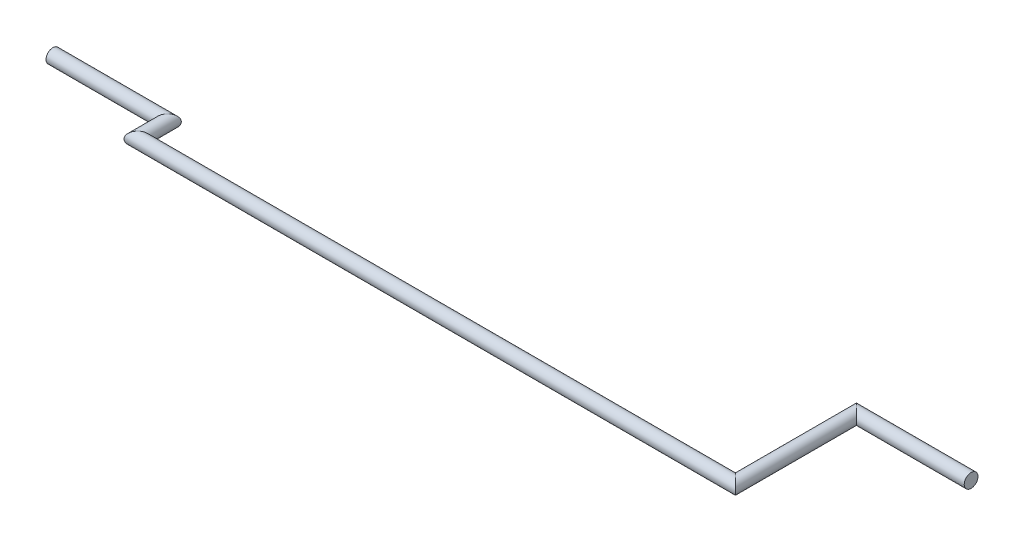
from build123d import *

# Parameters (mm, degrees)
SWEEP1_PROFILE_R = 0.6


with BuildPart() as part:
    # Sweep1: sweep along a path in Sketch1
    with BuildLine(Plane(origin=(0, 0, 0), x_dir=(1, 0, 0), z_dir=(0, 1, 0))) as sweep1_path:
        Line((62.11, 10.55), (52.11, 10.55))
        Line((52.11, 10.55), (52.11, 0))
        Line((52.11, 0), (0, 0))
        Line((0, 0), (0, 2.6))
        Line((0, 2.6), (-10, 2.6))
    # Sweep1 profile (on start of the path) → Sweep1 (sweep)
    with BuildSketch(Plane(origin=(62.11, 0, -10.55), x_dir=(0, 0, -1), z_dir=(-1, 0, 0))):
        Circle(SWEEP1_PROFILE_R)
    sweep(path=sweep1_path.line, transition=Transition.RIGHT)


solid = part.part
